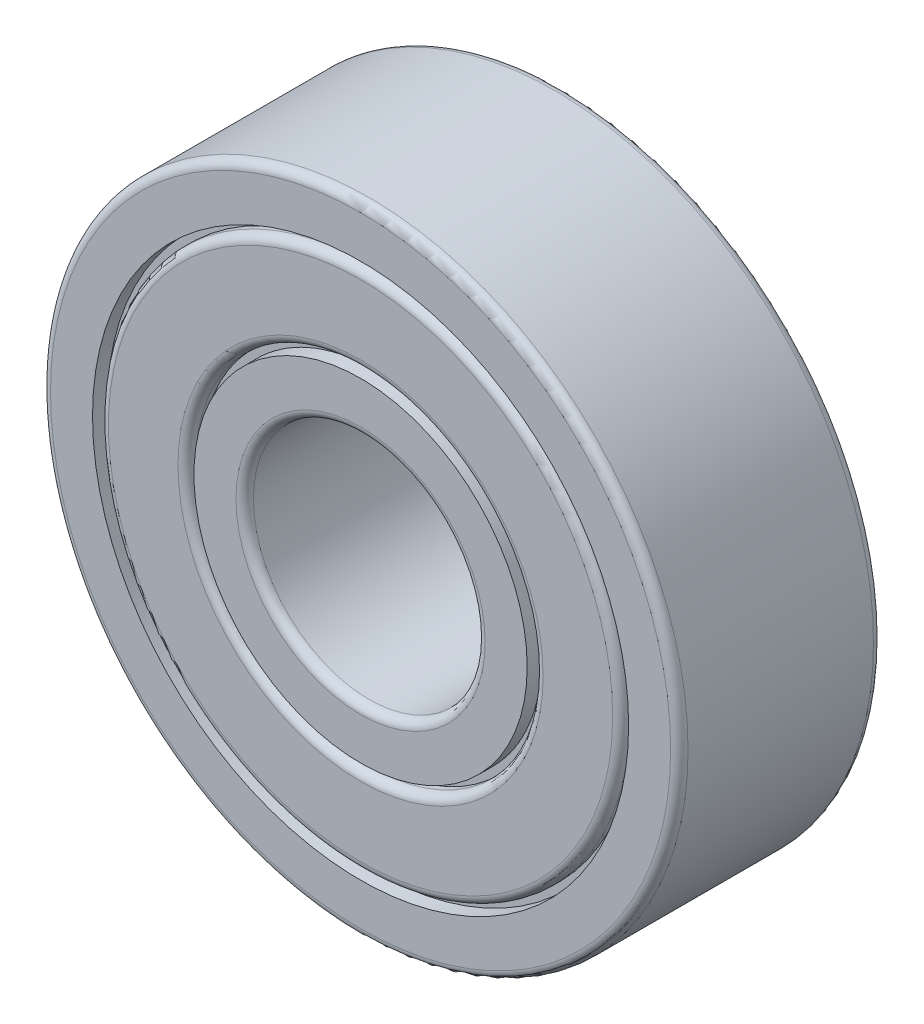
from build123d import *

# Parameters (mm, degrees)
SKETCH1_R           = 11
SKETCH1_R_2         = 4
BOSS_EXTRUDE1_DEPTH = 7
FILLET1_R           = 0.3
SKETCH2_R           = 9.25
SKETCH2_R_2         = 5.75
CUT_EXTRUDE1_DEPTH  = 18.058722174
SKETCH4_R           = 9
SKETCH4_R_2         = 6
BOSS_EXTRUDE2_DEPTH = 7
FILLET2_R           = 0.3
SKETCH5_W           = 6
SKETCH5_H           = 0.25


with BuildPart() as part:
    # Sketch1 → Boss-Extrude1 (new body)
    with BuildSketch(Plane.XY):
        Circle(SKETCH1_R)
        Circle(SKETCH1_R_2, mode=Mode.SUBTRACT)
    extrude(amount=BOSS_EXTRUDE1_DEPTH)

    # Fillet1
    fillet1_edges = [part.edges().sort_by_distance(p)[0] for p in [
        (-11, 0, 0),
        (-11, 0, 7),
        (-4, 0, 0),
        (-4, 0, 7),
    ]]
    fillet(fillet1_edges, radius=FILLET1_R)

    # Sketch2 → Cut-Extrude1 (cut, through all)
    with BuildSketch(Plane.XY.offset(7)):
        Circle(SKETCH2_R)
        Circle(SKETCH2_R_2, mode=Mode.SUBTRACT)
    extrude(amount=-CUT_EXTRUDE1_DEPTH, mode=Mode.SUBTRACT)


with BuildPart() as cut_extrude1_piece_1:
    # of the separate pieces the step leaves, piece 1, a body of its own (cut_extrude1_pieces)
    add(part.part.solids().sort_by_distance((11, 0, 0.3))[0])


with BuildPart() as cut_extrude1_piece_2:
    # of the separate pieces the step leaves, piece 2, a body of its own (cut_extrude1_pieces)
    add(part.part.solids().sort_by_distance((5.75, 0, 0))[0])


with BuildPart() as body_3:
    # Sketch4 → Boss-Extrude2 (new body)
    with BuildSketch(Plane.XY.offset(7)):
        Circle(SKETCH4_R)
        Circle(SKETCH4_R_2, mode=Mode.SUBTRACT)
    extrude(amount=-BOSS_EXTRUDE2_DEPTH)

    # Fillet2
    fillet2_edges = [body_3.edges().sort_by_distance(p)[0] for p in [
        (-9, 0, 7),
        (-6, 0, 7),
    ]]
    fillet(fillet2_edges, radius=FILLET2_R)

    # Sketch5 → Revolve2 (revolve)
    with BuildSketch(Plane(origin=(0, 0, 0), x_dir=(0, 0, -1), z_dir=(1, 0, 0)), mode=Mode.PRIVATE) as revolve2_sk:
        with Locations((-3.5, 9.125)):
            Rectangle(SKETCH5_W, SKETCH5_H)
        with Locations((-3.5, 5.875)):
            Rectangle(SKETCH5_W, SKETCH5_H)
    revolve(revolve2_sk.sketch.rotate(Axis((0, 0, -0.35), (0, 0, 1)), 270), axis=Axis((0, 0, -0.35), (0, 0, 1)))


solid = Compound([cut_extrude1_piece_1.part, cut_extrude1_piece_2.part, body_3.part])
